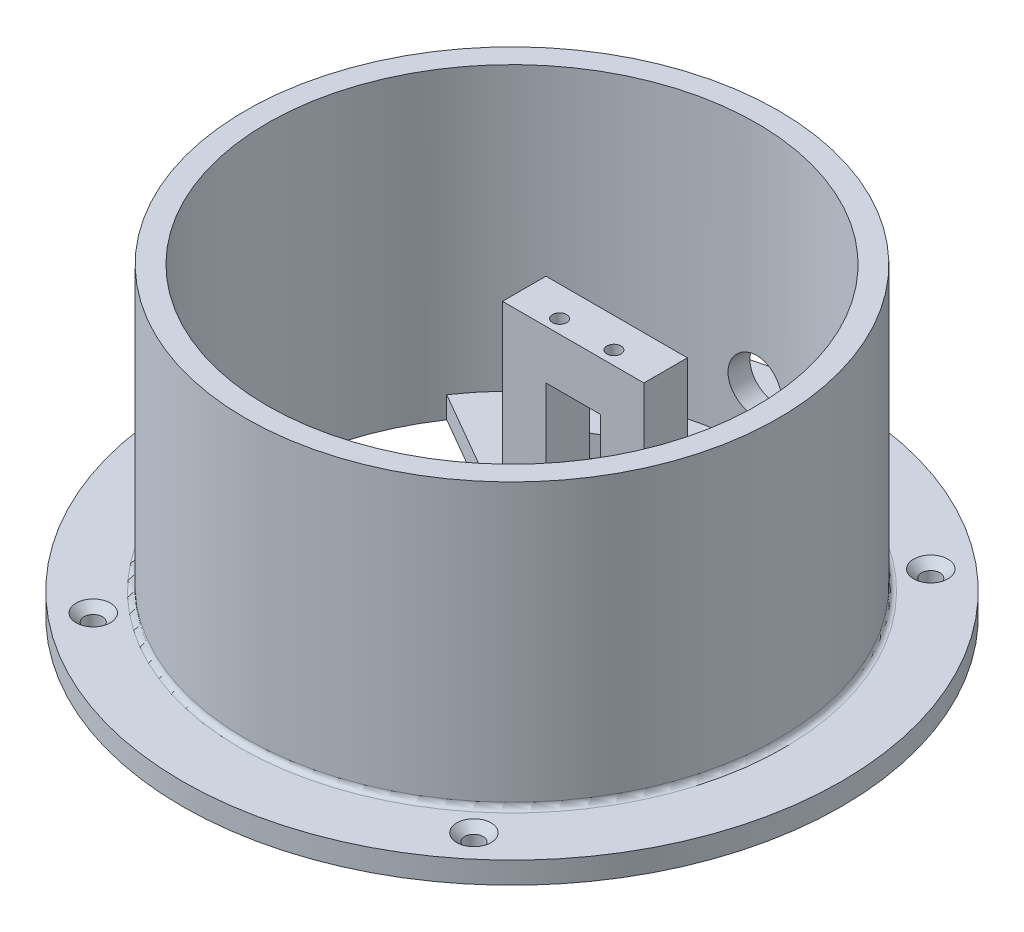
from build123d import *

# Parameters (mm, degrees)
SKETCH1_R                                           = 60.625
SKETCH1_R_2                                         = 45
BOSS_EXTRUDE1_DEPTH                                 = 4
SKETCH2_R                                           = 49
SKETCH2_R_2                                         = 45
BOSS_EXTRUDE2_DEPTH                                 = 52
SKETCH3_W                                           = 8
SKETCH3_H                                           = 38
BOSS_EXTRUDE3_DEPTH                                 = 13
SKETCH6_W                                           = 10
SKETCH6_H                                           = 24
CUT_EXTRUDE1_DEPTH                                  = 26
SKETCH7_R                                           = 5
CUT_EXTRUDE2_DEPTH                                  = 58
SKETCH8_R                                           = 1.3
CUT_EXTRUDE3_DEPTH                                  = 7.2
BOSS_EXTRUDE4_DEPTH                                 = 4
CSK_FOR_M3_COUNTERSUNK_FLAT_HEAD_SCREW1_D           = 3.4
CSK_FOR_M3_COUNTERSUNK_FLAT_HEAD_SCREW1_DEPTH       = 4
CSK_FOR_M3_COUNTERSUNK_FLAT_HEAD_SCREW1_CSINK_D     = 6.3
CSK_FOR_M3_COUNTERSUNK_FLAT_HEAD_SCREW1_CSINK_ANGLE = 90
CSK_FOR_M3_COUNTERSUNK_FLAT_HEAD_SCREW1_TIP         = 1.021463052
FILLET1_R                                           = 1


with BuildPart() as part:
    # Sketch1 → Boss-Extrude1 (new body)
    with BuildSketch(Plane(origin=(0, 0, 0), x_dir=(1, 0, 0), z_dir=(0, 1, 0))):
        with Locations(Location((0, 0, 0), (0, 0, 270))):
            Circle(SKETCH1_R)
        with Locations(Location((0, 0, 0), (0, 0, 270))):
            Circle(SKETCH1_R_2, mode=Mode.SUBTRACT)
    extrude(amount=BOSS_EXTRUDE1_DEPTH)

    # Sketch2 → Boss-Extrude2 (add)
    with BuildSketch(Plane(origin=(0, 4, 0), x_dir=(1, 0, 0), z_dir=(0, 1, 0))):
        with Locations(Location((0, 0, 0), (0, 0, 90))):
            Circle(SKETCH2_R)
        with Locations(Location((0, 0, 0), (0, 0, 270))):
            Circle(SKETCH2_R_2, mode=Mode.SUBTRACT)
    extrude(amount=BOSS_EXTRUDE2_DEPTH)

    # Sketch3 → Boss-Extrude3 (add, symmetric)
    with BuildSketch(Plane(origin=(0, 0, 0), x_dir=(0, 0, -1), z_dir=(1, 0, 0))):
        with Locations((15.25, 19)):
            Rectangle(SKETCH3_W, SKETCH3_H)
        Polygon((-45, 38), (-45, 30), (-39.75, 30), (-31.75, 38), align=None)
        Polygon((-39.75, 30), (-45, 30), (-45, 24.75), align=None)
        Polygon((-31.75, 38), (-39.75, 30), (-31.75, 30), align=None)
    extrude(amount=BOSS_EXTRUDE3_DEPTH, both=True)


with BuildPart() as boss_extrude3_piece_1:
    # of the separate pieces the step leaves, piece 1, a body of its own (boss_extrude3_pieces)
    add(part.part.solids().sort_by_distance((0, 0, 60.625))[0])

    # Sketch7 → Cut-Extrude2 (cut)
    with BuildSketch(Plane.XY.offset(-11.25)):
        with Locations(Location((0, 14, 0), (0, 0, 90))):
            Circle(SKETCH7_R)
    extrude(amount=-CUT_EXTRUDE2_DEPTH, mode=Mode.SUBTRACT)


with BuildPart() as boss_extrude3_piece_2:
    # of the separate pieces the step leaves, piece 2, a body of its own (boss_extrude3_pieces)
    add(part.part.solids().sort_by_distance((-13, 38, -19.25))[0])

    # Sketch6 → Cut-Extrude1 (cut)
    with BuildSketch(Plane.XY.offset(-11.25)):
        with Locations((0, 17)):
            Rectangle(SKETCH6_W, SKETCH6_H)
    extrude(amount=-CUT_EXTRUDE1_DEPTH, mode=Mode.SUBTRACT)


with BuildPart() as cut_extrude3_tool:
    # Sketch8 → Cut-Extrude3 (new body)
    with BuildSketch(Plane(origin=(0, 38, 0), x_dir=(1, 0, 0), z_dir=(0, 1, 0))):
        with Locations(Location((-5, 13.75, 0), (0, 0, 270))):
            Circle(SKETCH8_R)
        with Locations(Location((5, 13.75, 0), (0, 0, 270))):
            Circle(SKETCH8_R)
        with Locations(Location((-5, -34.25, 0), (0, 0, 270))):
            Circle(SKETCH8_R)
        with Locations(Location((5, -34.25, 0), (0, 0, 270))):
            Circle(SKETCH8_R)
    extrude(amount=-CUT_EXTRUDE3_DEPTH)


with BuildPart() as boss_extrude3_piece_1_1:
    add(boss_extrude3_piece_1.part)

    # Cut-Extrude3: cut by cut_extrude3_tool
    add(cut_extrude3_tool.part, mode=Mode.SUBTRACT)



with BuildPart() as boss_extrude3_piece_2_1:
    add(boss_extrude3_piece_2.part)

    # Cut-Extrude3: cut by cut_extrude3_tool
    add(cut_extrude3_tool.part, mode=Mode.SUBTRACT)


with BuildPart() as boss_extrude3_piece_1_2:
    add(boss_extrude3_piece_1_1.part)

    add(boss_extrude3_piece_2_1.part)  # Boss-Extrude4 merges Boss-Extrude3 piece 2
    # Sketch9 → Boss-Extrude4 (add)
    with BuildSketch(Plane.XZ):
        with BuildLine():
            Line((13, -11.25), (-13, -11.25))
            Line((-13, -11.25), (-37.248431585, -25.249838503))
            ThreePointArc((-37.248431585, -25.249838503), (0, -45), (37.248431585, -25.249838503))
            Line((37.248431585, -25.249838503), (13, -11.25))
        make_face()
        with BuildLine():
            Line((-19.516660498, -24.25), (-24.906460381, -27.361802413))
            ThreePointArc((-24.906460381, -27.361802413), (0, -37), (24.906460381, -27.361802413))
            Line((24.906460381, -27.361802413), (19.516660498, -24.25))
            Line((19.516660498, -24.25), (-19.516660498, -24.25))
        make_face(mode=Mode.SUBTRACT)
    extrude(amount=-BOSS_EXTRUDE4_DEPTH)

    # CSK for M3 Countersunk Flat Head Screw1
    with Locations(Plane(origin=(0, 4, 0), x_dir=(1, 0, 0), z_dir=(0, 1, 0))):
        with Locations((-35, 42), (35, 42), (35, -42), (-35, -42)):
            CounterSinkHole(CSK_FOR_M3_COUNTERSUNK_FLAT_HEAD_SCREW1_D / 2, CSK_FOR_M3_COUNTERSUNK_FLAT_HEAD_SCREW1_CSINK_D / 2, depth=CSK_FOR_M3_COUNTERSUNK_FLAT_HEAD_SCREW1_DEPTH, counter_sink_angle=CSK_FOR_M3_COUNTERSUNK_FLAT_HEAD_SCREW1_CSINK_ANGLE)
            with Locations((0, 0, -(CSK_FOR_M3_COUNTERSUNK_FLAT_HEAD_SCREW1_DEPTH + CSK_FOR_M3_COUNTERSUNK_FLAT_HEAD_SCREW1_TIP / 2))):  # 118° drill point
                Cone(0, CSK_FOR_M3_COUNTERSUNK_FLAT_HEAD_SCREW1_D / 2, CSK_FOR_M3_COUNTERSUNK_FLAT_HEAD_SCREW1_TIP, mode=Mode.SUBTRACT)

    # Fillet1
    fillet1_edges = [boss_extrude3_piece_1_2.edges().sort_by_distance(p)[0] for p in [
        (0, 4, 49),
    ]]
    fillet(fillet1_edges, radius=FILLET1_R)


solid = boss_extrude3_piece_1_2.part
